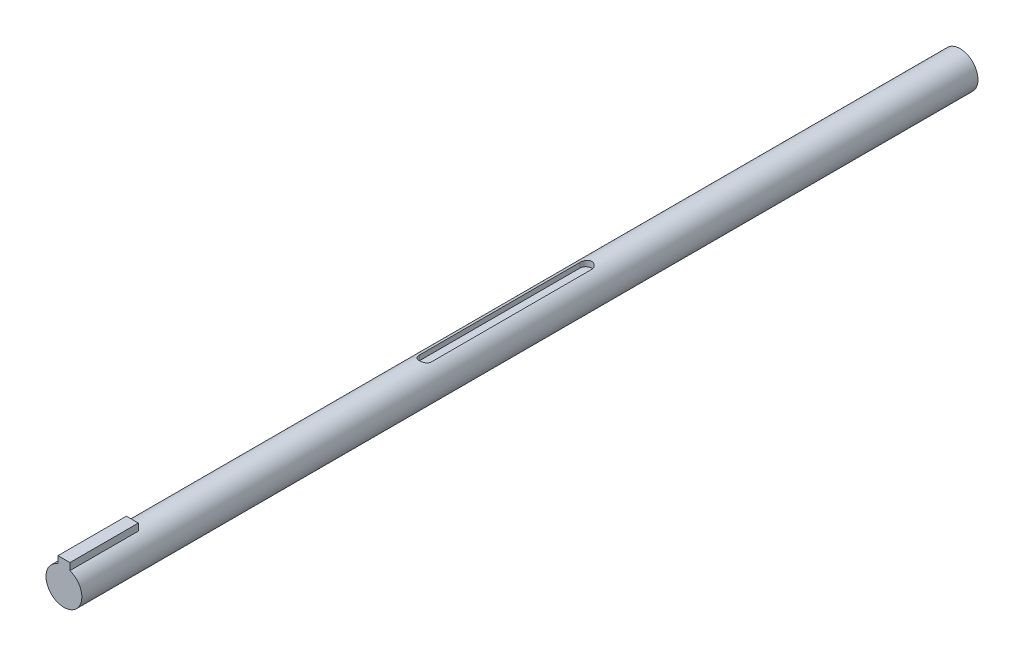
from build123d import *

# Parameters (mm, degrees)
SKETCH_1_R          = 6
EXTRUDE_1_DEPTH     = 300
SKETCH_2_W          = 4
SKETCH_2_H          = 5.416856643
EXTRUDE_2_DEPTH     = 22.91
CUT_EXTRUDE_START   = 6
CUT_EXTRUDE_1_DEPTH = 2


with BuildPart() as part:
    # 草图1 → 凸台-拉伸1 (new body)
    with BuildSketch(Plane.XY):
        Circle(SKETCH_1_R)
    extrude(amount=EXTRUDE_1_DEPTH)

    # 草图2 → 凸台-拉伸2 (add)
    with BuildSketch(Plane.XY.offset(300)):
        with Locations((0, 5.291571679)):
            Rectangle(SKETCH_2_W, SKETCH_2_H)
    extrude(amount=-EXTRUDE_2_DEPTH)

    # 草图3 → 切除-拉伸1 (cut)
    with BuildSketch(Plane(origin=(0, 0, 0), x_dir=(1, 0, 0), z_dir=(0, 1, 0)).offset(CUT_EXTRUDE_START)):
        with BuildLine():
            Line((2, -125.29796429), (2, -179.002027522))
            ThreePointArc((2, -179.002027522), (0, -181.002027522), (-2, -179.002027522))
            Line((-2, -179.002027522), (-2, -125.29796429))
            ThreePointArc((-2, -125.29796429), (0, -123.29796429), (2, -125.29796429))
        make_face()
    extrude(amount=-CUT_EXTRUDE_1_DEPTH, mode=Mode.SUBTRACT)


solid = part.part
